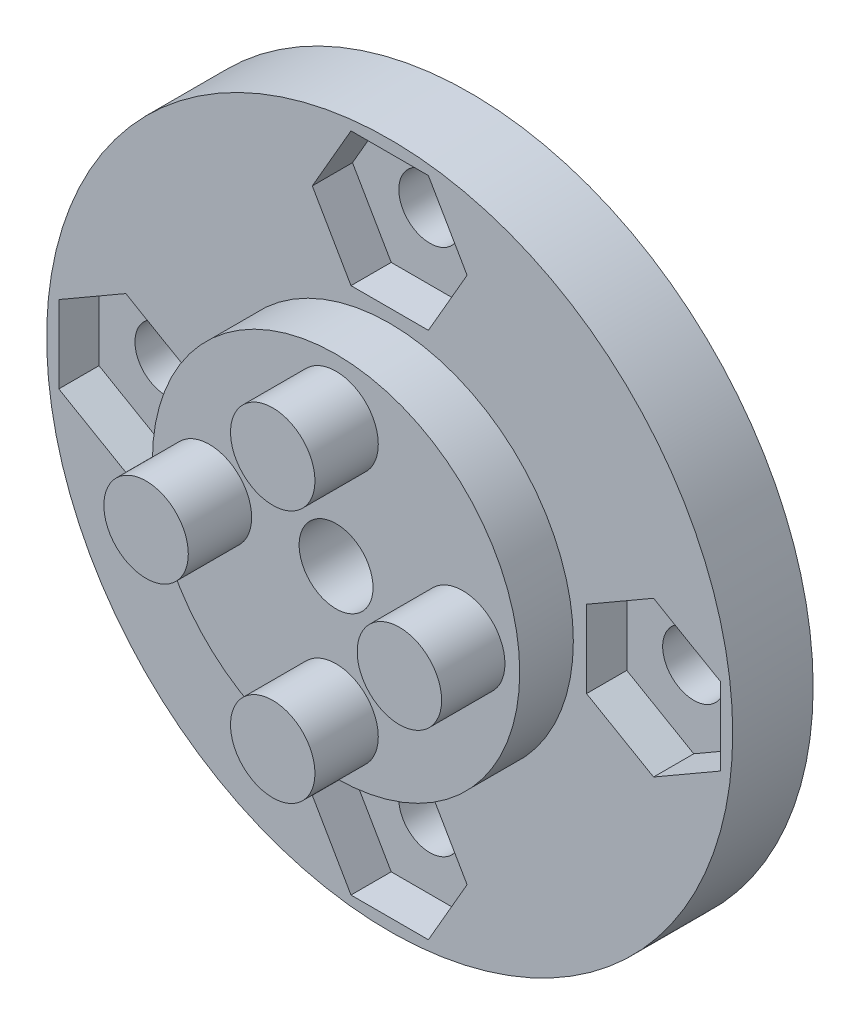
from build123d import *

# Parameters (mm, degrees)
SKETCH1_R             = 8.7
BOSS_EXTRUDE1_DEPTH   = 2.54
SKETCH2_R             = 2
BOSS_EXTRUDE2_DEPTH   = 3
SKETCH3_R             = 16.25
BOSS_EXTRUDE3_DEPTH   = 3.81
CUT_EXTRUDE1_DEPTH    = 1.905
F_4_CLEARANCE_HOLE1_D = 2.9464
CIRPATTERN1_COUNT     = 4
SKETCH8_R             = 1.75
CUT_EXTRUDE2_DEPTH    = 2.5
SKETCH9_R             = 3.5
CUT_EXTRUDE3_DEPTH    = 24.629959797


with BuildPart() as part:
    # Sketch1 → Boss-Extrude1 (new body)
    with BuildSketch(Plane.XY):
        Circle(SKETCH1_R)
    extrude(amount=BOSS_EXTRUDE1_DEPTH)

    # Sketch2 → Boss-Extrude2 (add)
    with BuildSketch(Plane.XY.offset(2.54)):
        with Locations((0, 6)):
            Circle(SKETCH2_R)
        with Locations((6, 0)):
            Circle(SKETCH2_R)
        with Locations((0, -6)):
            Circle(SKETCH2_R)
        with Locations((-6, 0)):
            Circle(SKETCH2_R)
    extrude(amount=BOSS_EXTRUDE2_DEPTH)

    # Sketch3 → Boss-Extrude3 (add)
    with BuildSketch(Plane(origin=(0, 0, 0), x_dir=(-1, 0, 0), z_dir=(0, 0, -1))):
        with Locations(Location((0, 0, 0), (0, 0, 180))):
            Circle(SKETCH3_R)
    extrude(amount=BOSS_EXTRUDE3_DEPTH)

    # Sketch4 → Cut-Extrude1 (cut)
    with BuildSketch(Plane.XY):
        Polygon((-12.5, 3.666174209), (-15.675, 1.833087105), (-15.675, -1.833087105), (-12.5, -3.666174209), (-9.325, -1.833087105), (-9.325, 1.833087105), align=None)
    cut_extrude1 = extrude(amount=-CUT_EXTRUDE1_DEPTH, mode=Mode.SUBTRACT)

    # #4 Clearance Hole1 (through all)
    with Locations(Plane.XY.offset(-1.905)):
        with Locations((-12.5, 0)):
            f_4_clearance_hole1 = Hole(F_4_CLEARANCE_HOLE1_D / 2)

    # CirPattern1: Cut-Extrude1, #4 Clearance Hole1 ×4 about axis
    cirpattern1_axis = Axis((0, 0, 0), (0, 0, 1))
    add([cut_extrude1.rotate(cirpattern1_axis, i * 360 / CIRPATTERN1_COUNT) for i in range(1, CIRPATTERN1_COUNT)], mode=Mode.SUBTRACT)
    add([f_4_clearance_hole1.rotate(cirpattern1_axis, i * 360 / CIRPATTERN1_COUNT) for i in range(1, CIRPATTERN1_COUNT)], mode=Mode.SUBTRACT)

    # Sketch8 → Cut-Extrude2 (cut)
    with BuildSketch(Plane.XY.offset(2.54)):
        Circle(SKETCH8_R)
    extrude(amount=-CUT_EXTRUDE2_DEPTH, mode=Mode.SUBTRACT)

    # Sketch9 → Cut-Extrude3 (cut, through all)
    with BuildSketch(Plane.XY.offset(0.04)):
        Circle(SKETCH9_R)
    extrude(amount=-CUT_EXTRUDE3_DEPTH, mode=Mode.SUBTRACT)


solid = part.part
